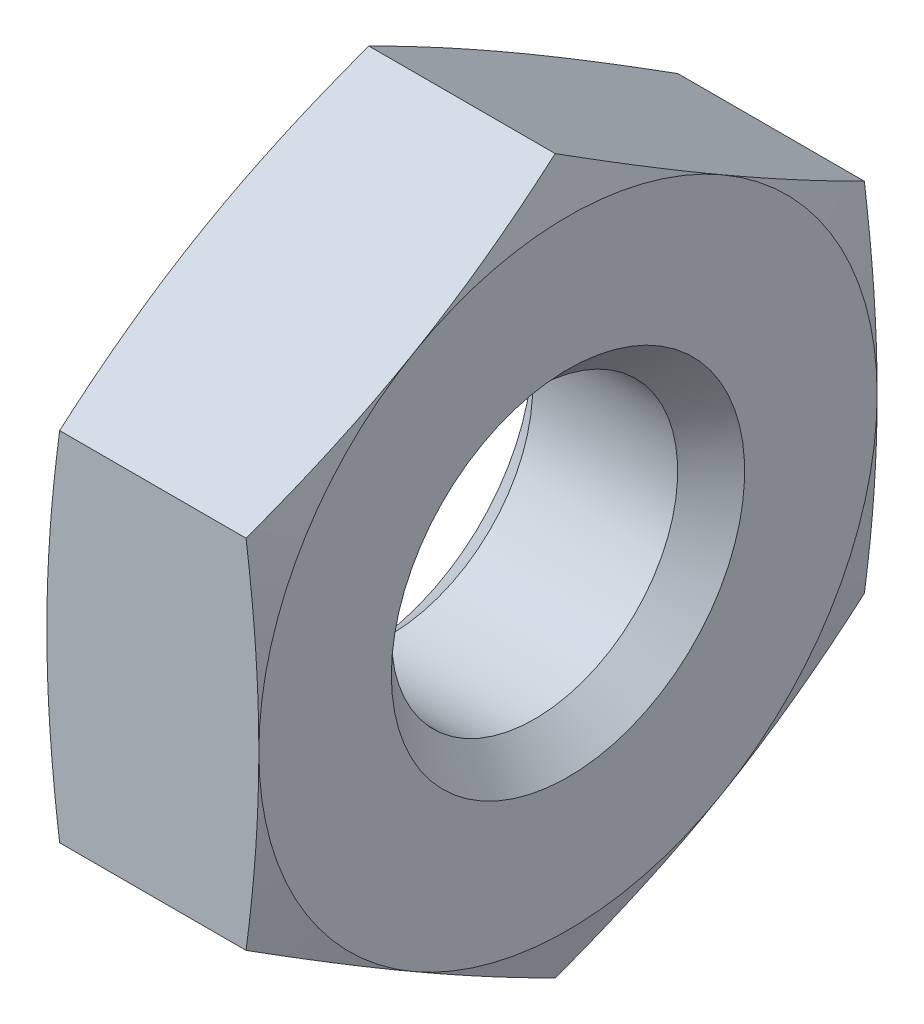
from build123d import *

# Parameters (mm, degrees)
SKETCH_2_R          = 20
CUT_EXTRUDE_1_DEPTH = 2.4


with BuildPart() as part:
    # 草图1 → 旋转1 (revolve)
    with BuildSketch(Plane.XY, mode=Mode.PRIVATE) as revolve_1_sk:
        Polygon((0, 3.5), (0, 2), (0.379, 1.621), (2.021, 1.621), (2.4, 2), (2.4, 3.5), (1.837306696, 5.6), (0.562693304, 5.6), align=None)
    revolve(revolve_1_sk.sketch.rotate(Axis((2.4, 0, 0), (-1, 0, 0)), 270), axis=Axis((2.4, 0, 0), (-1, 0, 0)))

    # 草图2 → 切除-拉伸1 (cut)
    with BuildSketch(Plane(origin=(0, 0, 0), x_dir=(0, 0, -1), z_dir=(1, 0, 0))):
        Circle(SKETCH_2_R)
        Polygon((-3.5, -2.020725942), (0, -4.041451884), (3.5, -2.020725942), (3.5, 2.020725942), (0, 4.041451884), (-3.5, 2.020725942), align=None, mode=Mode.SUBTRACT)
    extrude(amount=CUT_EXTRUDE_1_DEPTH, mode=Mode.SUBTRACT)


solid = part.part
